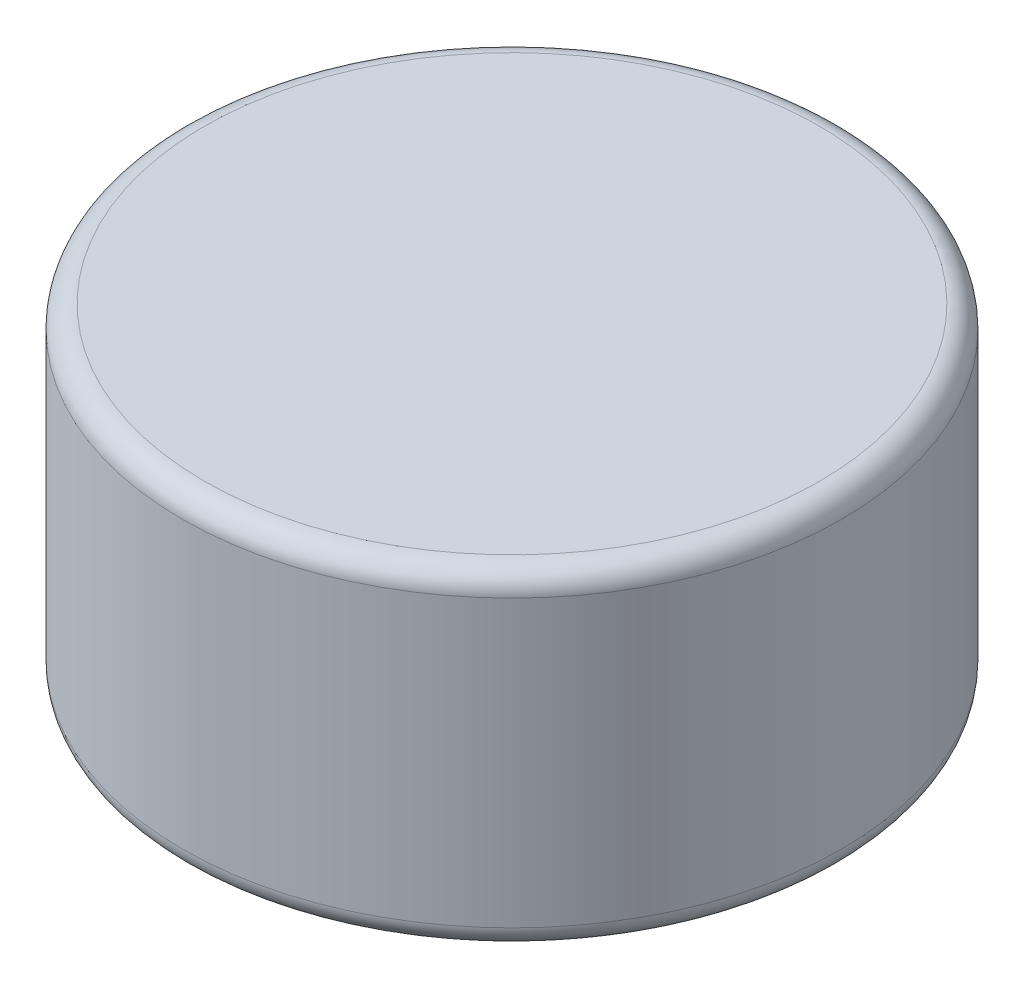
from build123d import *

# Parameters (mm, degrees)
SKETCH1_R           = 15
BOSS_EXTRUDE1_DEPTH = 15
FILLET1_R           = 1


with BuildPart() as part:
    # Sketch1 → Boss-Extrude1 (new body)
    with BuildSketch(Plane(origin=(0, 0, 0), x_dir=(1, 0, 0), z_dir=(0, 1, 0))):
        with Locations(Location((0, 0, 0), (0, 0, 270))):
            Circle(SKETCH1_R)
    extrude(amount=BOSS_EXTRUDE1_DEPTH)

    # Fillet1
    fillet1_edges = [part.edges().sort_by_distance(p)[0] for p in [
        (0, 0, -15),
        (0, 15, -15),
    ]]
    fillet(fillet1_edges, radius=FILLET1_R)


solid = part.part
